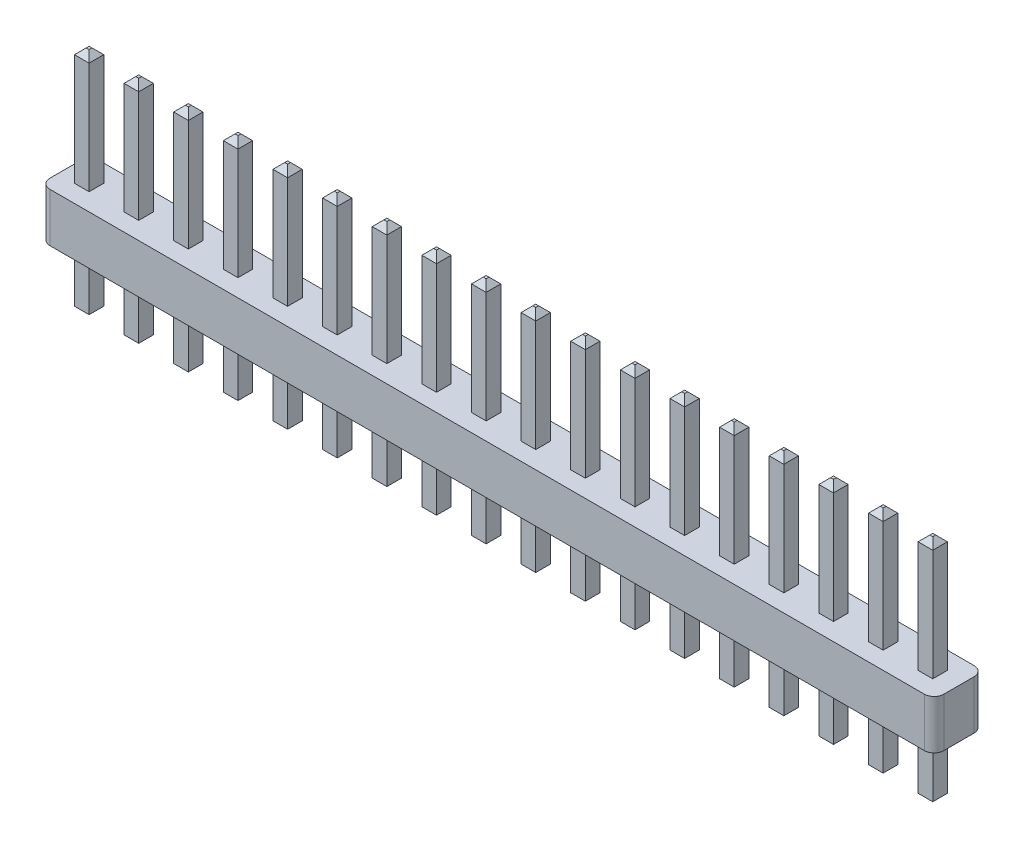
from build123d import *

# Parameters (mm, degrees)
BOSS_EXTRUDE1_DEPTH      = 2.5
BOSS_EXTRUDE2_DEPTH      = 8.5
BOSS_EXTRUDE2_DEPTH_BACK = 3.25
SKETCH2_W                = 0.75
SKETCH2_H                = 0.75
CHAMFER1_SIZE            = 0.3


with BuildPart() as part:
    # Sketch1 → Boss-Extrude1 (new body)
    with BuildSketch(Plane(origin=(0, 0, 0), x_dir=(-1, 0, 0), z_dir=(0, 1, 0))):
        with BuildLine():
            Line((-42.75, 1.27), (2, 1.27))
            ThreePointArc((2, 1.27), (2.353553391, 1.123553391), (2.5, 0.77))
            Line((2.5, 0.77), (2.5, -0.77))
            ThreePointArc((2.5, -0.77), (2.353553391, -1.123553391), (2, -1.27))
            Line((2, -1.27), (-42.75, -1.27))
            ThreePointArc((-42.75, -1.27), (-43.103553391, -1.123553391), (-43.25, -0.77))
            Line((-43.25, -0.77), (-43.25, 0.77))
            ThreePointArc((-43.25, 0.77), (-43.103553391, 1.123553391), (-42.75, 1.27))
        make_face()
    extrude(amount=BOSS_EXTRUDE1_DEPTH)

    # Sketch2 → Boss-Extrude2 (add, two sides: drawn at the far end of the back side and taken through both)
    with BuildSketch(Plane(origin=(0, 0, 0), x_dir=(-1, 0, 0), z_dir=(0, 1, 0)).offset(-BOSS_EXTRUDE2_DEPTH_BACK)):
        with Locations((1.27, 0)):
            Rectangle(SKETCH2_W, SKETCH2_H)
        with Locations((-1.27, 0)):
            Rectangle(SKETCH2_W, SKETCH2_H)
        with Locations((-3.81, 0)):
            Rectangle(SKETCH2_W, SKETCH2_H)
        with Locations((-6.35, 0)):
            Rectangle(SKETCH2_W, SKETCH2_H)
        with Locations((-8.89, 0)):
            Rectangle(SKETCH2_W, SKETCH2_H)
        with Locations((-11.43, 0)):
            Rectangle(SKETCH2_W, SKETCH2_H)
        with Locations((-13.97, 0)):
            Rectangle(SKETCH2_W, SKETCH2_H)
        with Locations((-16.51, 0)):
            Rectangle(SKETCH2_W, SKETCH2_H)
        with Locations((-19.05, 0)):
            Rectangle(SKETCH2_W, SKETCH2_H)
        with Locations((-21.59, 0)):
            Rectangle(SKETCH2_W, SKETCH2_H)
        with Locations((-24.13, 0)):
            Rectangle(SKETCH2_W, SKETCH2_H)
        with Locations((-26.67, 0)):
            Rectangle(SKETCH2_W, SKETCH2_H)
        with Locations((-29.21, 0)):
            Rectangle(SKETCH2_W, SKETCH2_H)
        with Locations((-31.75, 0)):
            Rectangle(SKETCH2_W, SKETCH2_H)
        with Locations((-34.29, 0)):
            Rectangle(SKETCH2_W, SKETCH2_H)
        with Locations((-36.83, 0)):
            Rectangle(SKETCH2_W, SKETCH2_H)
        with Locations((-39.37, 0)):
            Rectangle(SKETCH2_W, SKETCH2_H)
        with Locations((-41.91, 0)):
            Rectangle(SKETCH2_W, SKETCH2_H)
    extrude(amount=BOSS_EXTRUDE2_DEPTH + BOSS_EXTRUDE2_DEPTH_BACK)

    # Chamfer1
    chamfer1_edges = [part.edges().sort_by_distance(p)[0] for p in [
        (9.265, -3.25, 0),
        (8.89, -3.25, 0.375),
        (8.515, -3.25, 0),
        (8.89, -3.25, -0.375),
        (9.265, 8.5, 0),
        (8.89, 8.5, -0.375),
        (8.515, 8.5, 0),
        (8.89, 8.5, 0.375),
        (11.055, -3.25, 0),
        (11.43, -3.25, -0.375),
        (11.805, -3.25, 0),
        (11.43, -3.25, 0.375),
        (11.055, 8.5, 0),
        (11.43, 8.5, 0.375),
        (11.805, 8.5, 0),
        (11.43, 8.5, -0.375),
        (14.345, -3.25, 0),
        (13.97, -3.25, 0.375),
        (13.595, -3.25, 0),
        (13.97, -3.25, -0.375),
        (14.345, 8.5, 0),
        (13.97, 8.5, -0.375),
        (13.595, 8.5, 0),
        (13.97, 8.5, 0.375),
        (16.135, -3.25, 0),
        (16.51, -3.25, -0.375),
        (16.885, -3.25, 0),
        (16.51, -3.25, 0.375),
        (16.135, 8.5, 0),
        (16.51, 8.5, 0.375),
        (16.885, 8.5, 0),
        (16.51, 8.5, -0.375),
        (19.425, -3.25, 0),
        (19.05, -3.25, 0.375),
        (18.675, -3.25, 0),
        (19.05, -3.25, -0.375),
        (19.425, 8.5, 0),
        (19.05, 8.5, -0.375),
        (18.675, 8.5, 0),
        (19.05, 8.5, 0.375),
        (21.215, -3.25, 0),
        (21.59, -3.25, -0.375),
        (21.965, -3.25, 0),
        (21.59, -3.25, 0.375),
        (21.215, 8.5, 0),
        (21.59, 8.5, 0.375),
        (21.965, 8.5, 0),
        (21.59, 8.5, -0.375),
        (24.505, -3.25, 0),
        (24.13, -3.25, 0.375),
        (23.755, -3.25, 0),
        (24.13, -3.25, -0.375),
        (24.505, 8.5, 0),
        (24.13, 8.5, -0.375),
        (23.755, 8.5, 0),
        (24.13, 8.5, 0.375),
        (26.295, -3.25, 0),
        (26.67, -3.25, -0.375),
        (27.045, -3.25, 0),
        (26.67, -3.25, 0.375),
        (26.295, 8.5, 0),
        (26.67, 8.5, 0.375),
        (27.045, 8.5, 0),
        (26.67, 8.5, -0.375),
        (29.585, -3.25, 0),
        (29.21, -3.25, 0.375),
        (28.835, -3.25, 0),
        (29.21, -3.25, -0.375),
        (29.585, 8.5, 0),
        (29.21, 8.5, -0.375),
        (28.835, 8.5, 0),
        (29.21, 8.5, 0.375),
        (-0.895, -3.25, 0),
        (-1.27, -3.25, 0.375),
        (31.375, -3.25, 0),
        (31.75, -3.25, -0.375),
        (32.125, -3.25, 0),
        (31.75, -3.25, 0.375),
        (31.375, 8.5, 0),
        (31.75, 8.5, 0.375),
        (32.125, 8.5, 0),
        (31.75, 8.5, -0.375),
        (-1.645, -3.25, 0),
        (-1.27, -3.25, -0.375),
        (34.665, -3.25, 0),
        (34.29, -3.25, 0.375),
        (33.915, -3.25, 0),
        (34.29, -3.25, -0.375),
        (34.665, 8.5, 0),
        (34.29, 8.5, -0.375),
        (-0.895, 8.5, 0),
        (33.915, 8.5, 0),
        (34.29, 8.5, 0.375),
        (-1.27, 8.5, -0.375),
        (-1.645, 8.5, 0),
        (-1.27, 8.5, 0.375),
        (36.455, -3.25, 0),
        (36.83, -3.25, -0.375),
        (37.205, -3.25, 0),
        (36.83, -3.25, 0.375),
        (36.455, 8.5, 0),
        (36.83, 8.5, 0.375),
        (37.205, 8.5, 0),
        (36.83, 8.5, -0.375),
        (39.745, -3.25, 0),
        (39.37, -3.25, 0.375),
        (38.995, -3.25, 0),
        (39.37, -3.25, -0.375),
        (39.745, 8.5, 0),
        (39.37, 8.5, -0.375),
        (38.995, 8.5, 0),
        (39.37, 8.5, 0.375),
        (41.535, -3.25, 0),
        (41.91, -3.25, -0.375),
        (42.285, -3.25, 0),
        (41.91, -3.25, 0.375),
        (41.535, 8.5, 0),
        (41.91, 8.5, 0.375),
        (42.285, 8.5, 0),
        (41.91, 8.5, -0.375),
        (0.895, -3.25, 0),
        (1.27, -3.25, -0.375),
        (1.645, -3.25, 0),
        (1.27, -3.25, 0.375),
        (0.895, 8.5, 0),
        (1.27, 8.5, 0.375),
        (1.645, 8.5, 0),
        (1.27, 8.5, -0.375),
        (4.185, -3.25, 0),
        (3.81, -3.25, 0.375),
        (3.435, -3.25, 0),
        (3.81, -3.25, -0.375),
        (4.185, 8.5, 0),
        (3.81, 8.5, -0.375),
        (3.435, 8.5, 0),
        (3.81, 8.5, 0.375),
        (5.975, -3.25, 0),
        (6.35, -3.25, -0.375),
        (6.725, -3.25, 0),
        (6.35, -3.25, 0.375),
        (5.975, 8.5, 0),
        (6.35, 8.5, 0.375),
        (6.725, 8.5, 0),
        (6.35, 8.5, -0.375),
    ]]
    chamfer(chamfer1_edges, length=CHAMFER1_SIZE)


solid = part.part
